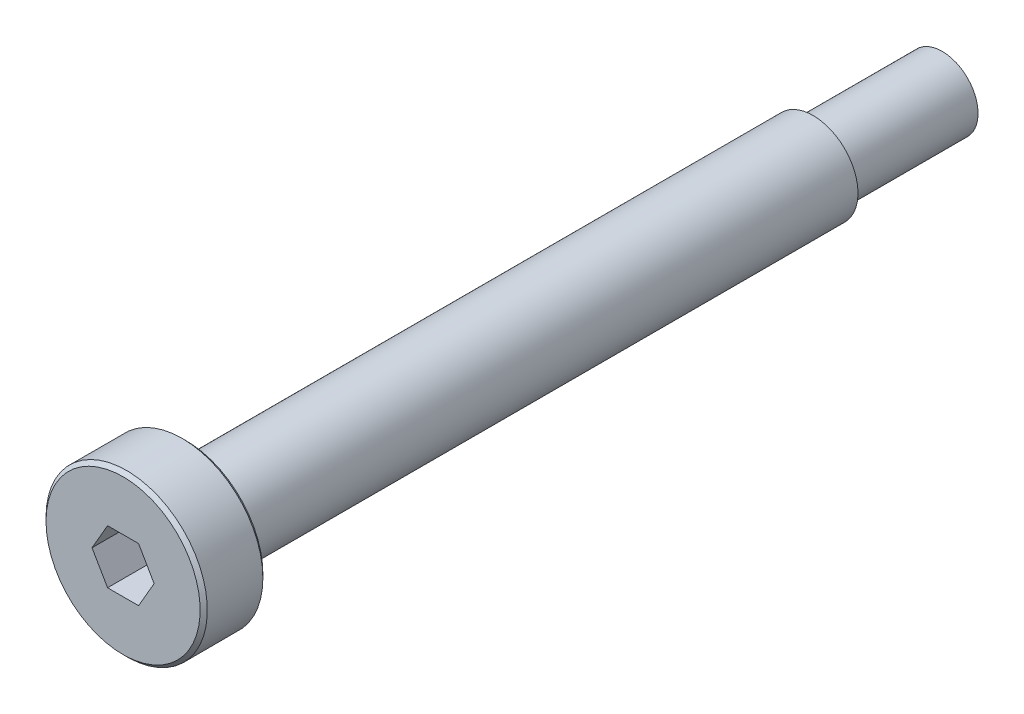
from build123d import *

# Parameters (mm, degrees)
CUT_EXTRUDE_1_DEPTH = 3
CHAMFER_1_SIZE      = 0.2


with BuildPart() as part:
    # 草图1 → 旋转1 (revolve)
    with BuildSketch(Plane.YZ, mode=Mode.PRIVATE) as revolve_1_sk:
        Polygon((0, 0), (-4.5, 0), (-4.5, -3.5), (-2.5, -3.5), (-2.5, -38.5), (-2, -38.5), (-2, -45.7), (0, -45.7), align=None)
    revolve(revolve_1_sk.sketch.rotate(Axis((0, 0, -45.7), (0, 0, 1)), 270), axis=Axis((0, 0, -45.7), (0, 0, 1)))

    # 草图2 → 切除-拉伸1 (cut)
    with BuildSketch(Plane.XY):
        Polygon((1.732050808, 0), (0.866025404, 1.5), (-0.866025404, 1.5), (-1.732050808, 0), (-0.866025404, -1.5), (0.866025404, -1.5), align=None)
    extrude(amount=-CUT_EXTRUDE_1_DEPTH, mode=Mode.SUBTRACT)

    # 倒角1
    chamfer_1_edges = [part.edges().sort_by_distance(p)[0] for p in [
        (4.5, 0, -3.5),
        (4.5, 0, 0),
    ]]
    chamfer(chamfer_1_edges, length=CHAMFER_1_SIZE)


solid = part.part
